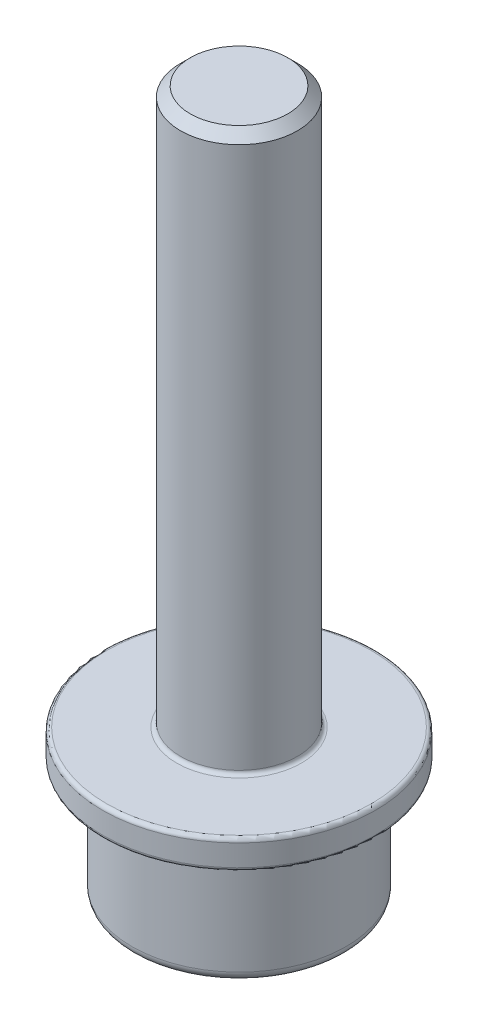
from build123d import *

# Parameters (mm, degrees)
SKETCH1_R           = 2.75
BOSS_EXTRUDE1_DEPTH = 3
SKETCH2_R           = 1.5
BOSS_EXTRUDE2_DEPTH = 15
CUT_EXTRUDE1_DEPTH  = 1.5
CHAMFER1_SIZE       = 0.25
FILLET1_R           = 0.25
CHAMFER2_SIZE       = 0.25
FILLET2_R           = 0.1
SKETCH4_R           = 3.5
SKETCH4_R_2         = 1.5
BOSS_EXTRUDE3_DEPTH = 0.75
FILLET3_R           = 0.1


with BuildPart() as part:
    # Sketch1 → Boss-Extrude1 (new body)
    with BuildSketch(Plane(origin=(0, 0, 0), x_dir=(1, 0, 0), z_dir=(0, 1, 0))):
        with Locations(Location((0, 0, 0), (0, 0, 270))):
            Circle(SKETCH1_R)
    extrude(amount=BOSS_EXTRUDE1_DEPTH)

    # Sketch2 → Boss-Extrude2 (add)
    with BuildSketch(Plane(origin=(0, 3, 0), x_dir=(1, 0, 0), z_dir=(0, 1, 0))):
        with Locations(Location((0, 0, 0), (0, 0, 270))):
            Circle(SKETCH2_R)
    extrude(amount=BOSS_EXTRUDE2_DEPTH)

    # Sketch3 → Cut-Extrude1 (cut)
    with BuildSketch(Plane.XZ):
        Polygon((0.934168857, 0.974591477), (-0.376936549, 1.2963097), (-1.311105406, 0.321718223), (-0.934168857, -0.974591477), (0.376936549, -1.2963097), (1.311105406, -0.321718223), align=None)
    extrude(amount=-CUT_EXTRUDE1_DEPTH, mode=Mode.SUBTRACT)

    # Chamfer1
    chamfer1_edges = [part.edges().sort_by_distance(p)[0] for p in [
        (1.122637131, 0, 0.326436627),
        (0.278616154, 0, 1.135450588),
        (-0.844020977, 0, 0.809013962),
        (-1.122637131, 0, -0.326436627),
        (-0.278616154, 0, -1.135450588),
        (0.844020977, 0, -0.809013962),
    ]]
    chamfer(chamfer1_edges, length=CHAMFER1_SIZE)

    # Fillet1
    fillet1_edges = [part.edges().sort_by_distance(p)[0] for p in [
        (0, 0, -2.75),
    ]]
    fillet(fillet1_edges, radius=FILLET1_R)

    # Chamfer2
    chamfer2_edges = [part.edges().sort_by_distance(p)[0] for p in [
        (0, 18, -1.5),
    ]]
    chamfer(chamfer2_edges, length=CHAMFER2_SIZE)

    # Fillet2
    fillet2_edges = [part.edges().sort_by_distance(p)[0] for p in [
        (0, 3, -2.75),
    ]]
    fillet(fillet2_edges, radius=FILLET2_R)

    # Sketch4 → Boss-Extrude3 (add)
    with BuildSketch(Plane(origin=(0, 3, 0), x_dir=(1, 0, 0), z_dir=(0, 1, 0))):
        with Locations(Location((0, 0, 0), (0, 0, 270))):
            Circle(SKETCH4_R)
        with Locations(Location((0, 0, 0), (0, 0, 270))):
            Circle(SKETCH4_R_2, mode=Mode.SUBTRACT)
    extrude(amount=BOSS_EXTRUDE3_DEPTH)

    # Fillet3
    fillet3_edges = [part.edges().sort_by_distance(p)[0] for p in [
        (0, 3.75, -3.5),
        (0, 3, -3.5),
        (0, 3.75, -1.5),
    ]]
    fillet(fillet3_edges, radius=FILLET3_R)


solid = part.part
